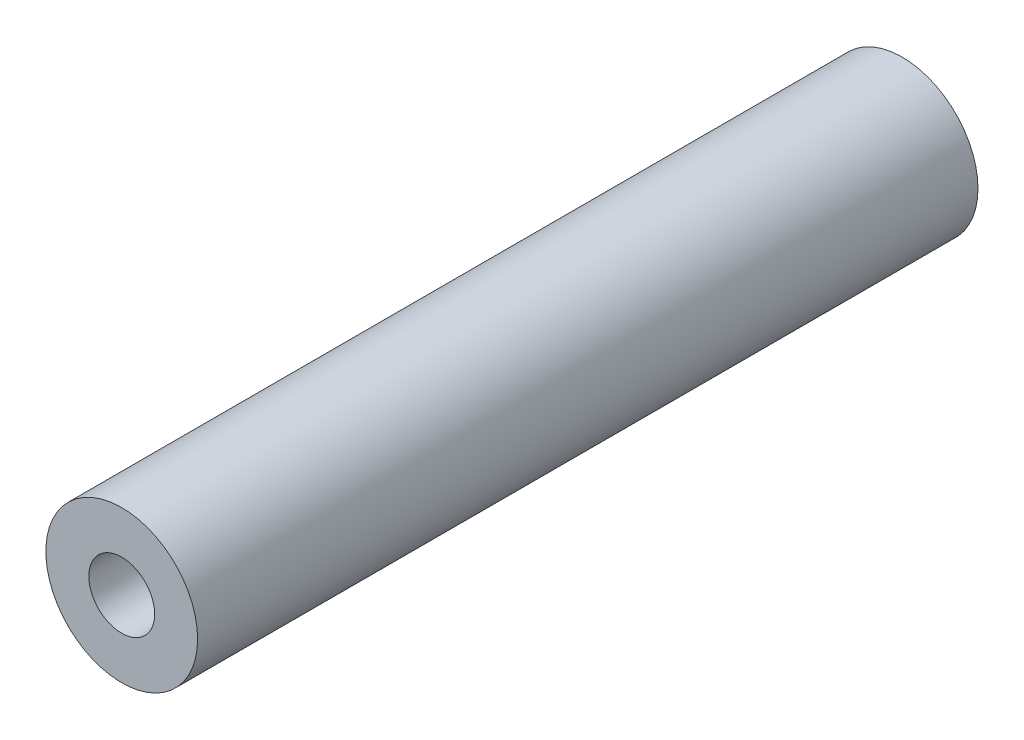
from build123d import *

# Parameters (mm, degrees)
SKETCH_36MM_POST_R                  = 3.5
F_36MM_POST_DEPTH                   = 36
M3_NOMINAL_THREAD_ENVELOPE_START    = -1
SKETCH_M3_NOMINAL_THREAD_ENVELOPE_R = 1.52
M3_NOMINAL_THREAD_ENVELOPE_DEPTH    = 38


with BuildPart() as part:
    # Sketch_36mm_post → 36mm_post (new body)
    with BuildSketch(Plane.XY):
        Circle(SKETCH_36MM_POST_R)
    extrude(amount=F_36MM_POST_DEPTH)

    # Sketch_M3_nominal_thread_envelope → M3_nominal_thread_envelope (cut)
    with BuildSketch(Plane.XY.offset(M3_NOMINAL_THREAD_ENVELOPE_START)):
        Circle(SKETCH_M3_NOMINAL_THREAD_ENVELOPE_R)
    extrude(amount=M3_NOMINAL_THREAD_ENVELOPE_DEPTH, mode=Mode.SUBTRACT)


solid = part.part
